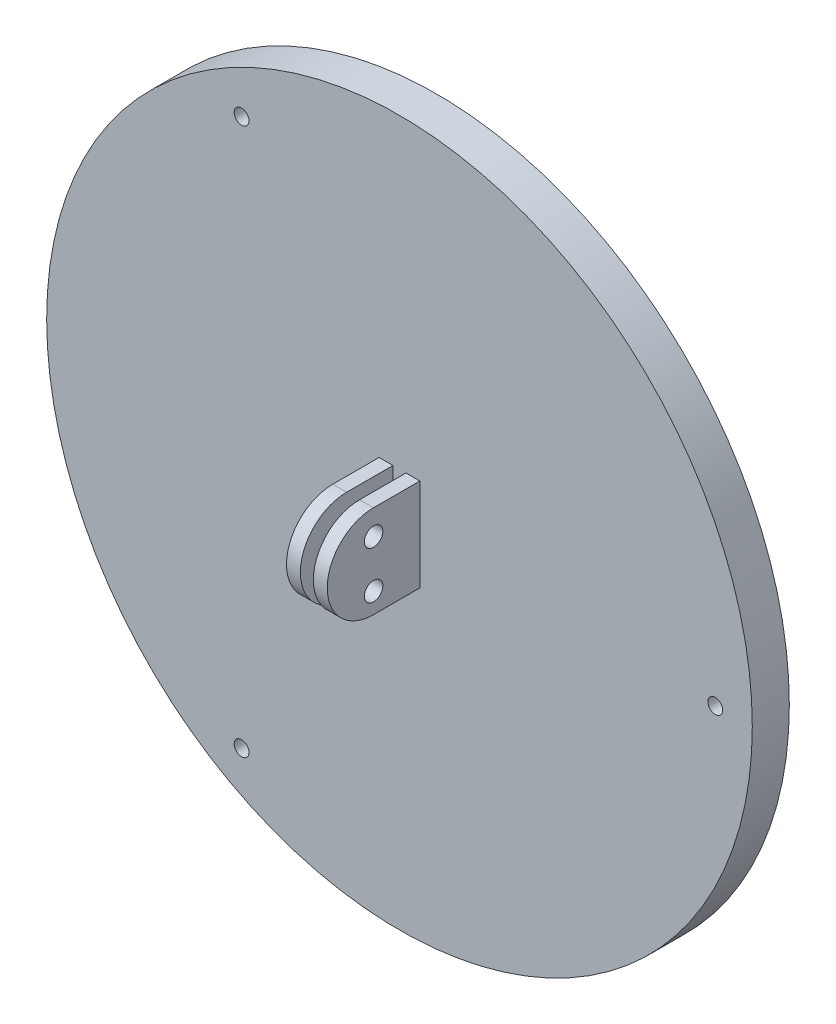
from build123d import *

# Parameters (mm, degrees)
SKETCH2_R           = 38.1
BOSS_EXTRUDE1_DEPTH = 4
SKETCH3_R           = 0.8
CUT_EXTRUDE1_DEPTH  = 6
SKETCH4_R           = 0.6
CUT_EXTRUDE2_DEPTH  = 6
SKETCH5_W           = 1.5
SKETCH5_H           = 10
BOSS_EXTRUDE2_DEPTH = 10
CUT_EXTRUDE3_DEPTH  = 58.198776211
SKETCH7_R           = 1
CUT_EXTRUDE4_DEPTH  = 58.198776211


with BuildPart() as part:
    # Sketch2 → Boss-Extrude1 (new body)
    with BuildSketch(Plane.XY):
        Circle(SKETCH2_R)
    extrude(amount=BOSS_EXTRUDE1_DEPTH)

    # Sketch3 → Cut-Extrude1 (cut)
    with BuildSketch(Plane.XY.offset(4)):
        with Locations((34.1, -0.085721815)):
            Circle(SKETCH3_R)
        with Locations((-17.05, -29.617188084)):
            Circle(SKETCH3_R)
        with Locations((-17.05, 29.445744454)):
            Circle(SKETCH3_R)
    extrude(amount=-CUT_EXTRUDE1_DEPTH, mode=Mode.SUBTRACT)

    # Sketch4 → Cut-Extrude2 (cut)
    with BuildSketch(Plane.XY.offset(4)):
        Circle(SKETCH4_R)
    extrude(amount=-CUT_EXTRUDE2_DEPTH, mode=Mode.SUBTRACT)

    # Sketch5 → Boss-Extrude2 (add)
    with BuildSketch(Plane.XY.offset(4)):
        with Locations((1.45, 0)):
            Rectangle(SKETCH5_W, SKETCH5_H)
        with Locations((-1.45, 0)):
            Rectangle(SKETCH5_W, SKETCH5_H)
    extrude(amount=BOSS_EXTRUDE2_DEPTH)

    # Sketch6 → Cut-Extrude3 (cut, through all)
    with BuildSketch(Plane(origin=(2.2, 0, 0), x_dir=(0, 0, -1), z_dir=(1, 0, 0))):
        with BuildLine():
            ThreePointArc((-14, 0), (-12.535533906, 3.535533906), (-9, 5))
            Line((-9, 5), (-14, 5))
            Line((-14, 5), (-14, 0))
        make_face()
        with BuildLine():
            ThreePointArc((-9, -5), (-12.535533906, -3.535533906), (-14, 0))
            Line((-14, 0), (-14, -5))
            Line((-14, -5), (-9, -5))
        make_face()
    extrude(amount=-CUT_EXTRUDE3_DEPTH, mode=Mode.SUBTRACT)

    # Sketch7 → Cut-Extrude4 (cut, through all)
    with BuildSketch(Plane(origin=(2.2, 0, 0), x_dir=(0, 0, -1), z_dir=(1, 0, 0))):
        with Locations(Location((-9, 2.3, 0), (0, 0, 90))):
            Circle(SKETCH7_R)
        with Locations(Location((-9, -2.8, 0), (0, 0, 90))):
            Circle(SKETCH7_R)
    extrude(amount=-CUT_EXTRUDE4_DEPTH, mode=Mode.SUBTRACT)


solid = part.part
